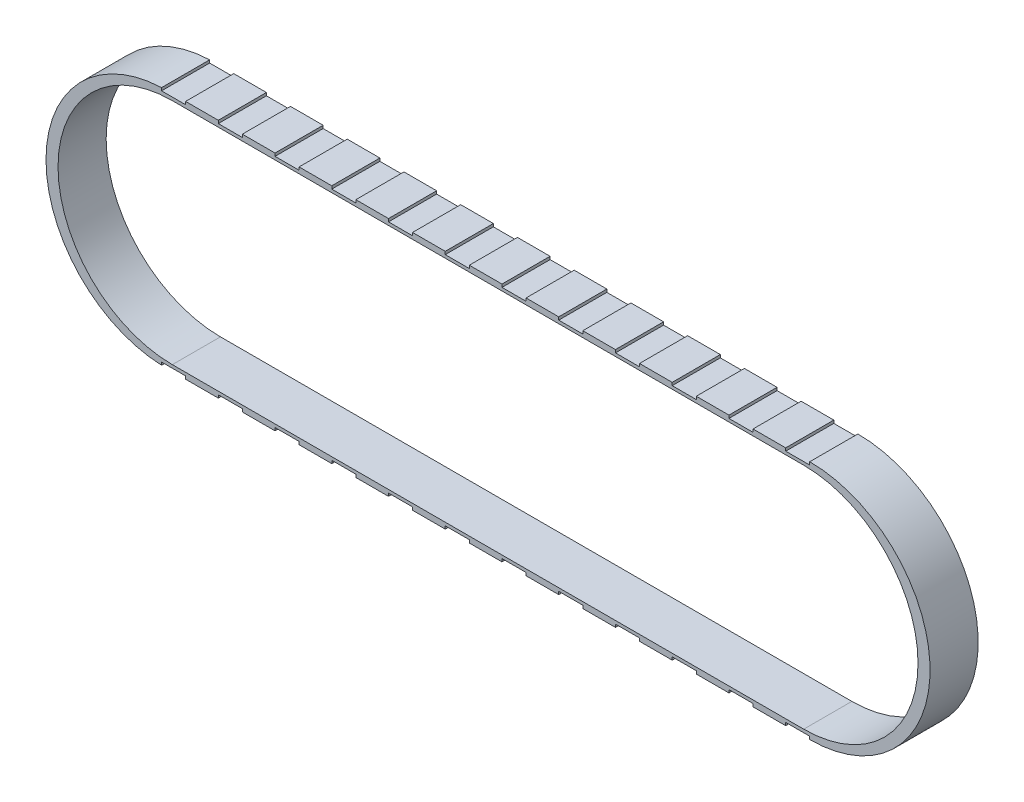
from build123d import *

# Parameters (mm, degrees)
BOSS_EXTRUDE4_DEPTH = 12.7
CUT_EXTRUDE4_DEPTH  = 12.7
SKETCH13_W          = 6.35
SKETCH13_H          = 0.762
CUT_EXTRUDE5_DEPTH  = 12.7
LPATTERN3_COUNT     = 12
LPATTERN3_PITCH     = 14.9733
SKETCH14_W          = 6.35
SKETCH14_H          = 0.762
CUT_EXTRUDE6_DEPTH  = 12.7
LPATTERN4_COUNT     = 12
LPATTERN4_PITCH     = 14.9733


with BuildPart() as part:
    # Sketch11 → Boss-Extrude4 (new body)
    with BuildSketch(Plane.XY):
        with BuildLine():
            Line((-84.8995, 31.75), (84.8995, 31.75))
            ThreePointArc((84.8995, 31.75), (116.6495, 0), (84.8995, -31.75))
            Line((84.8995, -31.75), (-84.8995, -31.75))
            ThreePointArc((-84.8995, -31.75), (-116.6495, 0), (-84.8995, 31.75))
        make_face()
    extrude(amount=BOSS_EXTRUDE4_DEPTH)

    # Sketch12 → Cut-Extrude4 (cut)
    with BuildSketch(Plane.XY.offset(12.7)):
        with BuildLine():
            Line((-83.312, 30.1625), (83.312, 30.1625))
            ThreePointArc((83.312, 30.1625), (113.4745, 0), (83.312, -30.1625))
            Line((83.312, -30.1625), (-83.312, -30.1625))
            ThreePointArc((-83.312, -30.1625), (-113.4745, 0), (-83.312, 30.1625))
        make_face()
    extrude(amount=-CUT_EXTRUDE4_DEPTH, mode=Mode.SUBTRACT)

    # Sketch13 → Cut-Extrude5 (cut)
    with BuildSketch(Plane(origin=(0, 0, 0), x_dir=(-1, 0, 0), z_dir=(0, 0, -1))):
        with Locations((-81.7245, 31.369)):
            Rectangle(SKETCH13_W, SKETCH13_H)
    cut_extrude5 = extrude(amount=-CUT_EXTRUDE5_DEPTH, mode=Mode.SUBTRACT)

    # LPattern3: Cut-Extrude5 ×12
    with Locations(*[(-i * LPATTERN3_PITCH, 0, 0) for i in range(1, LPATTERN3_COUNT)]):
        add(cut_extrude5, mode=Mode.SUBTRACT)

    # Sketch14 → Cut-Extrude6 (cut)
    with BuildSketch(Plane(origin=(0, 0, 0), x_dir=(-1, 0, 0), z_dir=(0, 0, -1))):
        with Locations((-81.7245, -31.369)):
            Rectangle(SKETCH14_W, SKETCH14_H)
    cut_extrude6 = extrude(amount=-CUT_EXTRUDE6_DEPTH, mode=Mode.SUBTRACT)

    # LPattern4: Cut-Extrude6 ×12
    with Locations(*[(-i * LPATTERN4_PITCH, 0, 0) for i in range(1, LPATTERN4_COUNT)]):
        add(cut_extrude6, mode=Mode.SUBTRACT)


solid = part.part
